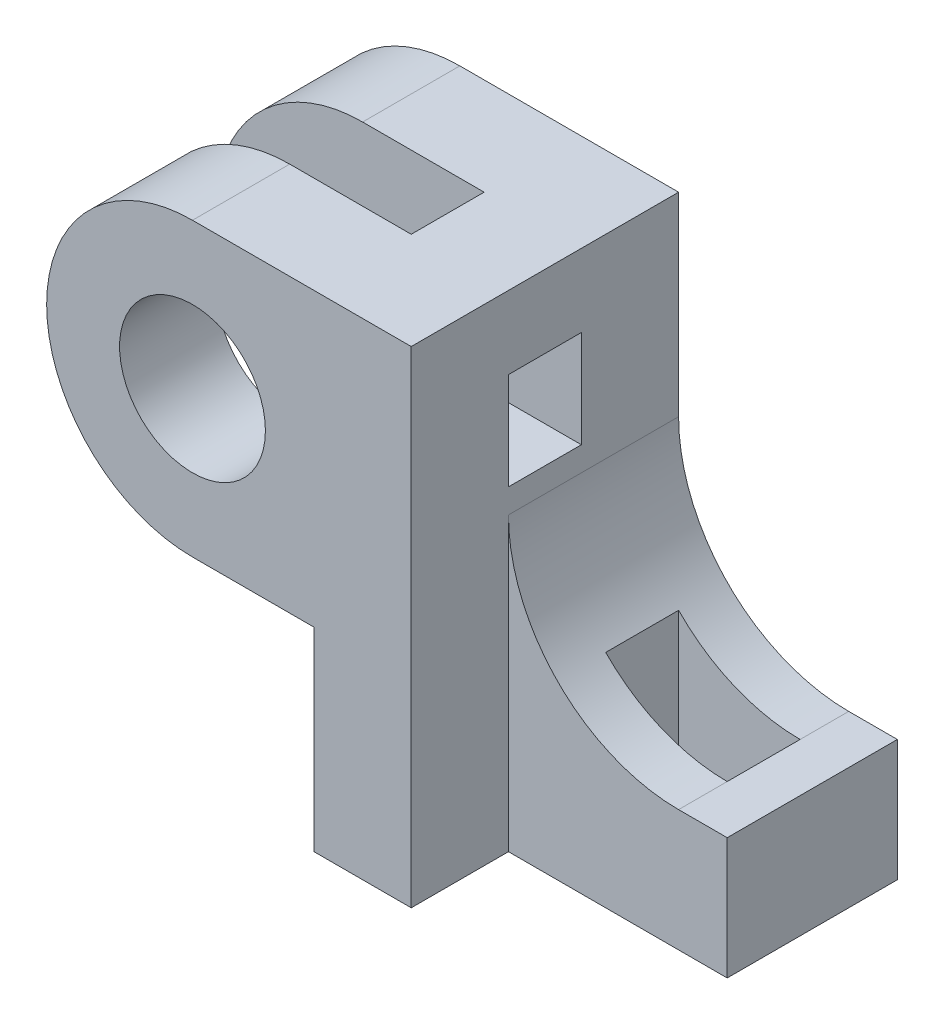
from build123d import *

# Parameters (mm, degrees)
SKETCH1_R           = 15
BOSS_EXTRUDE1_DEPTH = 27.5
CUT_EXTRUDE1_REACH  = 129.989
SKETCH2_W           = 55
SKETCH2_H           = 15
BOSS_EXTRUDE2_DEPTH = 35
CUT_EXTRUDE2_REACH  = 129.989
SKETCH5_W           = 15
SKETCH5_H           = 20
CUT_EXTRUDE3_REACH  = 129.989
SKETCH6_W           = 25
SKETCH6_H           = 15


with BuildPart() as part:
    # Sketch1 → Boss-Extrude1 (new, symmetric)
    with BuildSketch(Plane.XY):
        with BuildLine():
            Line((0, 0), (0, 100))
            Line((0, 100), (-45, 100))
            ThreePointArc((-45, 100), (-75, 70), (-45, 40))
            Line((-45, 40), (-20, 40))
            Line((-20, 40), (-20, 0))
            Line((-20, 0), (0, 0))
        make_face()
        with Locations((-45, 70)):
            Circle(SKETCH1_R, mode=Mode.SUBTRACT)
    extrude(amount=BOSS_EXTRUDE1_DEPTH, both=True)

    # Sketch2 → Cut-Extrude1 (cut, up to next)
    with BuildSketch(Plane(origin=(0, 100, 0), x_dir=(1, 0, 0), z_dir=(0, 1, 0)), mode=Mode.PRIVATE) as cut_extrude1_sk1:
        with Locations((-47.5, 0)):
            Rectangle(SKETCH2_W, SKETCH2_H)
    cut_extrude1_tool1 = extrude(cut_extrude1_sk1.sketch, amount=-CUT_EXTRUDE1_REACH, mode=Mode.PRIVATE) & part.part
    add(cut_extrude1_tool1.solids().sort_by_distance((-47.5, 100, 0))[0], mode=Mode.SUBTRACT)

    # Sketch4 → Boss-Extrude2 (add)
    with BuildSketch(Plane(origin=(0, 0, -27.5), x_dir=(-1, 0, 0), z_dir=(0, 0, -1))):
        with BuildLine():
            Line((-45, 0), (0, 0))
            Line((0, 0), (0, 60))
            ThreePointArc((0, 60), (-10.251262658, 35.251262658), (-35, 25))
            Line((-35, 25), (-45, 25))
            Line((-45, 25), (-45, 0))
        make_face()
    extrude(amount=-BOSS_EXTRUDE2_DEPTH)

    # Sketch5 → Cut-Extrude2 (cut, up to next)
    with BuildSketch(Plane(origin=(0, 0, 0), x_dir=(0, 0, -1), z_dir=(1, 0, 0)), mode=Mode.PRIVATE) as cut_extrude2_sk1:
        with Locations((0, 75)):
            Rectangle(SKETCH5_W, SKETCH5_H)
    cut_extrude2_tool1 = extrude(cut_extrude2_sk1.sketch, amount=-CUT_EXTRUDE2_REACH, mode=Mode.PRIVATE) & part.part
    add(cut_extrude2_tool1.solids().sort_by_distance((0, 75, 0))[0], mode=Mode.SUBTRACT)

    # Sketch6 → Cut-Extrude3 (cut, up to next)
    with BuildSketch(Plane.XZ, mode=Mode.PRIVATE) as cut_extrude3_sk1:
        with Locations((22.5, -10)):
            Rectangle(SKETCH6_W, SKETCH6_H)
    cut_extrude3_tool1 = extrude(cut_extrude3_sk1.sketch, amount=-CUT_EXTRUDE3_REACH, mode=Mode.PRIVATE) & part.part
    add(cut_extrude3_tool1.solids().sort_by_distance((22.5, 0, -10))[0], mode=Mode.SUBTRACT)


solid = part.part
